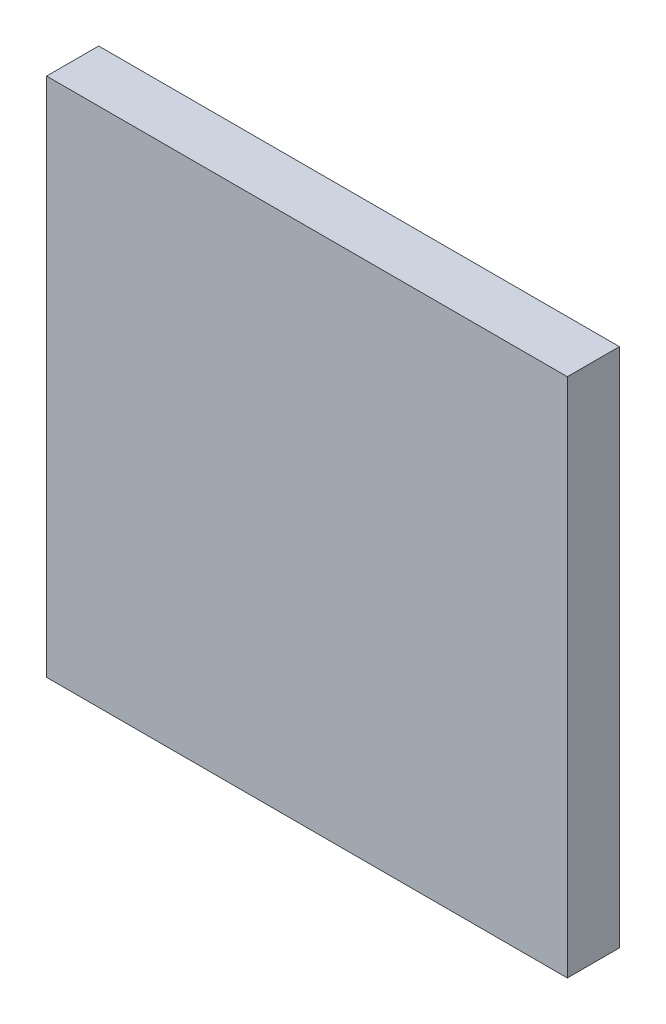
from build123d import *

# Parameters (mm, degrees)
SKETCH1_W      = 25.4
SKETCH1_H      = 25.4
EXTRUDE1_DEPTH = 2.54


with BuildPart() as part:
    # Sketch1 → Extrude1 (new body)
    with BuildSketch(Plane.XY):
        with Locations((12.7, 12.7)):
            Rectangle(SKETCH1_W, SKETCH1_H)
    extrude(amount=EXTRUDE1_DEPTH)


solid = part.part
